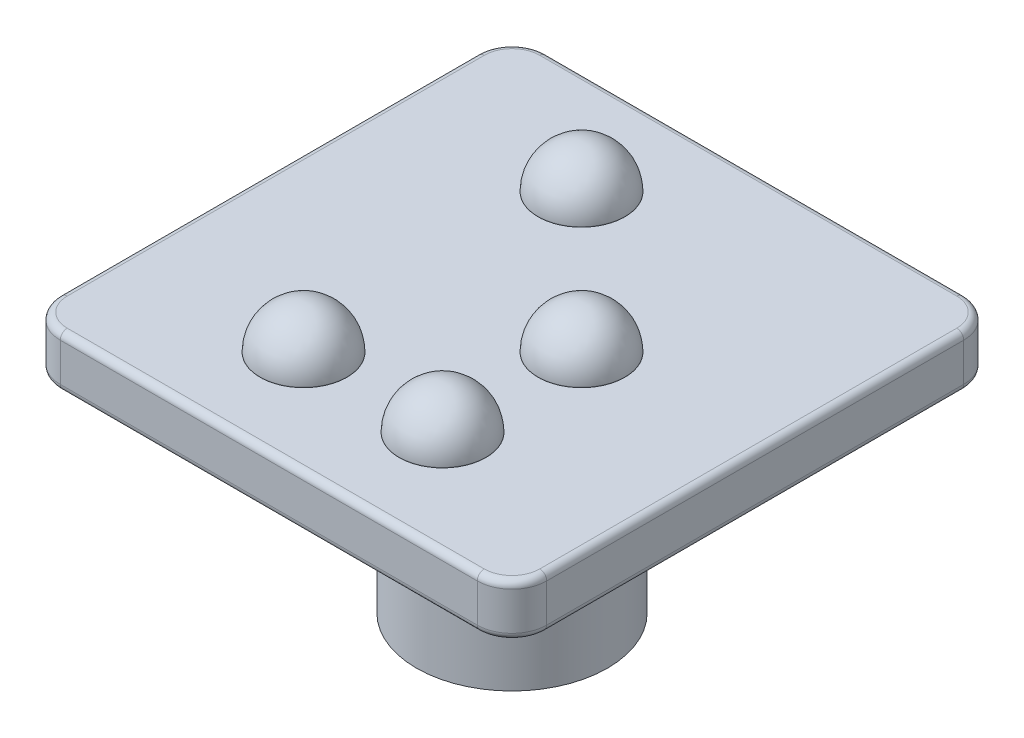
from build123d import *

# Parameters (mm, degrees)
BOSS_EXTRUDE1_DEPTH = 1.5
SKETCH2_R           = 2.75
BOSS_EXTRUDE2_DEPTH = 6
SKETCH3_W           = 1.1
SKETCH3_H           = 1.45
SKETCH3_W_2         = 1.45
SKETCH3_H_2         = 1.1
CUT_EXTRUDE1_DEPTH  = 6
CHAMFER1_SIZE       = 0.3
FILLET1_R           = 1
SKETCH4_R           = 1.25
BOSS_EXTRUDE3_DEPTH = 0.01
DOME1_FACE_RADIUS   = 1.25
DOME1_HEIGHT        = 1.25
DOME4_FACE_RADIUS   = 1.25
DOME4_HEIGHT        = 1.25
DOME5_FACE_RADIUS   = 1.25
DOME5_HEIGHT        = 1.25
DOME6_FACE_RADIUS   = 1.25
DOME6_HEIGHT        = 1.25
FILLET3_R           = 0.2


with BuildPart() as part:
    # Sketch1 → Boss-Extrude1 (new body)
    with BuildSketch(Plane(origin=(0, 0, 0), x_dir=(1, 0, 0), z_dir=(0, 1, 0))):
        with BuildLine():
            Line((-7.324675649, 4.396717546), (4.675324351, 4.396717546))
            ThreePointArc((4.675324351, 4.396717546), (5.382431132, 4.103824327), (5.675324351, 3.396717546))
            Line((5.675324351, 3.396717546), (5.675324351, -8.603282454))
            ThreePointArc((5.675324351, -8.603282454), (5.382431132, -9.310389235), (4.675324351, -9.603282454))
            Line((4.675324351, -9.603282454), (-7.324675649, -9.603282454))
            ThreePointArc((-7.324675649, -9.603282454), (-8.03178243, -9.310389235), (-8.324675649, -8.603282454))
            Line((-8.324675649, -8.603282454), (-8.324675649, 3.396717546))
            ThreePointArc((-8.324675649, 3.396717546), (-8.03178243, 4.103824327), (-7.324675649, 4.396717546))
        make_face()
    extrude(amount=BOSS_EXTRUDE1_DEPTH)

    # Sketch2 → Boss-Extrude2 (add)
    with BuildSketch(Plane.XZ):
        with Locations(Location((-1.324675649, 2.603282454, 0), (0, 0, 270))):
            Circle(SKETCH2_R)
    extrude(amount=BOSS_EXTRUDE2_DEPTH)

    # Sketch3 → Cut-Extrude1 (cut)
    with BuildSketch(Plane.XZ.offset(6)):
        with Locations((-1.324675649, 3.878282454)):
            Rectangle(SKETCH3_W, SKETCH3_H)
        with Locations((-0.049675649, 2.603282454)):
            Rectangle(SKETCH3_W_2, SKETCH3_H_2)
        with Locations((-1.324675649, 2.603282454)):
            Rectangle(SKETCH3_W, SKETCH3_H_2)
        with Locations((-2.599675649, 2.603282454)):
            Rectangle(SKETCH3_W_2, SKETCH3_H_2)
        with Locations((-1.324675649, 1.328282454)):
            Rectangle(SKETCH3_W, SKETCH3_H)
    extrude(amount=-CUT_EXTRUDE1_DEPTH, mode=Mode.SUBTRACT)

    # Chamfer1
    chamfer1_edges = [part.edges().sort_by_distance(p)[0] for p in [
        (-0.774675649, -6, 3.878282454),
        (-0.049675649, -6, 3.153282454),
        (0.675324351, -6, 2.603282454),
        (-0.774675649, -6, 1.328282454),
        (-2.599675649, -6, 3.153282454),
        (-1.324675649, -6, 4.603282454),
        (-1.874675649, -6, 3.878282454),
        (-3.324675649, -6, 2.603282454),
        (-2.599675649, -6, 2.053282454),
        (-1.874675649, -6, 1.328282454),
        (-1.324675649, -6, 0.603282454),
        (-0.049675649, -6, 2.053282454),
    ]]
    chamfer(chamfer1_edges, length=CHAMFER1_SIZE)

    # Fillet1
    fillet1_edges = [part.edges().sort_by_distance(p)[0] for p in [
        (-1.324675649, 0, 5.353282454),
    ]]
    fillet(fillet1_edges, radius=FILLET1_R)

    # Sketch4 → Boss-Extrude3 (add)
    with BuildSketch(Plane(origin=(0, 1.5, 0), x_dir=(1, 0, 0), z_dir=(0, 1, 0))):
        with Locations(Location((-3.324675649, 1.396717546, 0), (0, 0, 90))):
            Circle(SKETCH4_R)
        with Locations(Location((0.675324351, -2.603282454, 0), (0, 0, 90))):
            Circle(SKETCH4_R)
        with Locations(Location((-3.324675649, -6.603282454, 0), (0, 0, 90))):
            Circle(SKETCH4_R)
        with Locations(Location((0.675324351, -6.603282454, 0), (0, 0, 90))):
            Circle(SKETCH4_R)
    extrude(amount=BOSS_EXTRUDE3_DEPTH)

    # Dome1: a dome of height H over a round flat face of radius A is a cap of a sphere of radius (A * A + H * H) / (2 * H)
    dome1_r = (DOME1_FACE_RADIUS * DOME1_FACE_RADIUS + DOME1_HEIGHT * DOME1_HEIGHT) / (2 * DOME1_HEIGHT)
    dome1_base = Plane((-3.324675649, 1.51, -1.396717546), z_dir=(0, 1, 0))
    with Locations(dome1_base.offset(DOME1_HEIGHT - dome1_r)):
        dome1_ball = Sphere(dome1_r, mode=Mode.PRIVATE)
    add(split(dome1_ball, bisect_by=dome1_base, keep=Keep.TOP, mode=Mode.PRIVATE))

    # Dome4: a dome of height H over a round flat face of radius A is a cap of a sphere of radius (A * A + H * H) / (2 * H)
    dome4_r = (DOME4_FACE_RADIUS * DOME4_FACE_RADIUS + DOME4_HEIGHT * DOME4_HEIGHT) / (2 * DOME4_HEIGHT)
    dome4_base = Plane((0.675324351, 1.51, 2.603282454), z_dir=(0, 1, 0))
    with Locations(dome4_base.offset(DOME4_HEIGHT - dome4_r)):
        dome4_ball = Sphere(dome4_r, mode=Mode.PRIVATE)
    add(split(dome4_ball, bisect_by=dome4_base, keep=Keep.TOP, mode=Mode.PRIVATE))

    # Dome5: a dome of height H over a round flat face of radius A is a cap of a sphere of radius (A * A + H * H) / (2 * H)
    dome5_r = (DOME5_FACE_RADIUS * DOME5_FACE_RADIUS + DOME5_HEIGHT * DOME5_HEIGHT) / (2 * DOME5_HEIGHT)
    dome5_base = Plane((-3.324675649, 1.51, 6.603282454), z_dir=(0, 1, 0))
    with Locations(dome5_base.offset(DOME5_HEIGHT - dome5_r)):
        dome5_ball = Sphere(dome5_r, mode=Mode.PRIVATE)
    add(split(dome5_ball, bisect_by=dome5_base, keep=Keep.TOP, mode=Mode.PRIVATE))

    # Dome6: a dome of height H over a round flat face of radius A is a cap of a sphere of radius (A * A + H * H) / (2 * H)
    dome6_r = (DOME6_FACE_RADIUS * DOME6_FACE_RADIUS + DOME6_HEIGHT * DOME6_HEIGHT) / (2 * DOME6_HEIGHT)
    dome6_base = Plane((0.675324351, 1.51, 6.603282454), z_dir=(0, 1, 0))
    with Locations(dome6_base.offset(DOME6_HEIGHT - dome6_r)):
        dome6_ball = Sphere(dome6_r, mode=Mode.PRIVATE)
    add(split(dome6_ball, bisect_by=dome6_base, keep=Keep.TOP, mode=Mode.PRIVATE))

    # Fillet3
    fillet3_edges = [part.edges().sort_by_distance(p)[0] for p in [
        (5.382431132, 1.5, 9.310389235),
        (-1.324675649, 0, 9.603282454),
        (-8.03178243, 0, 9.310389235),
        (5.675324351, 1.5, 2.603282454),
        (5.382431132, 1.5, -4.103824327),
        (-1.324675649, 1.5, -4.396717546),
        (-8.03178243, 1.5, -4.103824327),
        (-8.324675649, 1.5, 2.603282454),
        (-8.03178243, 1.5, 9.310389235),
        (-1.324675649, 1.5, 9.603282454),
        (-8.324675649, 0, 2.603282454),
        (-8.03178243, 0, -4.103824327),
        (-1.324675649, 0, -4.396717546),
        (5.382431132, 0, -4.103824327),
        (5.675324351, 0, 2.603282454),
        (5.382431132, 0, 9.310389235),
    ]]
    fillet(fillet3_edges, radius=FILLET3_R)


solid = part.part
